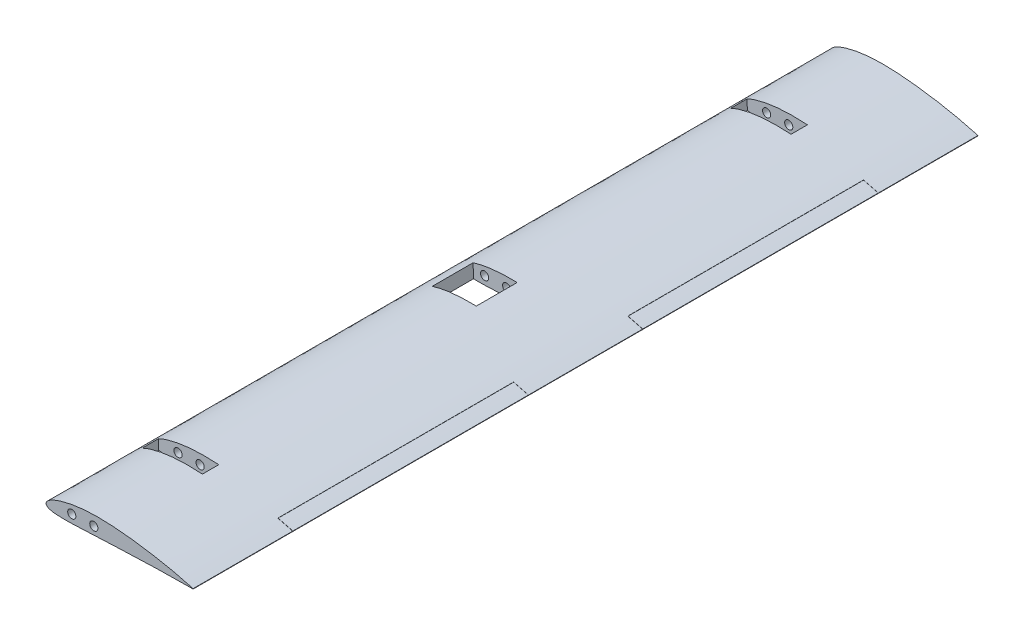
from build123d import *

# Parameters (mm, degrees)
SKETCH2_R               = 6.35
EXTRUDE_AIRFOIL_DEPTH   = 1219.2
AILERONS_DEPTH          = 1241.930446903
AILERONS_DEPTH_BACK     = 1241.930446903
CUT_EXTRUDE1_DEPTH      = 1241.650515326
CUT_EXTRUDE1_DEPTH_BACK = 1241.650515326
SKETCH5_W               = 25.4
SKETCH5_H               = 93.98
SKETCH5_W_2             = 63.5
SKETCH5_H_2             = 68.58


with BuildPart() as part:
    # Sketch2 → Extrude airfoil (new body)
    with BuildSketch(Plane.XY):
        with BuildLine():
            Line((228.6, 12.387025086), (228.6, 11.792831891))
            add(Edge.make_bspline(
                [(228.6, 12.387025086), (224.79499634, 13.422833003), (217.203351463, 15.489450166), (201.995086366, 19.24706995), (182.976626701, 23.398782778), (160.101034919, 27.491378445), (137.243176809, 30.846032277), (114.372582505, 33.23890504), (91.503980941, 34.73131665), (72.412997667, 34.746410141), (57.169927463, 33.691843848), (45.722178876, 32.302790192), (34.249688597, 30.254339076), (24.742840243, 27.790786051), (17.124502123, 25.302700119), (11.38009907, 22.953832003), (6.478661385, 20.413593164), (2.224209454, 17.375019555), (-1.479318567, 12.488031674), (2.518152586, 8.750563835), (6.597176672, 7.283468722), (11.455013829, 6.293244116), (17.192107473, 5.789786203), (24.819037957, 5.433479126), (34.346917188, 5.460166768), (45.776283997, 5.77999863), (57.197586321, 6.388979964), (72.433369023, 7.101546318), (91.474845089, 8.015960902), (114.332736884, 8.874603332), (137.183285679, 9.828052553), (160.036020936, 10.640146808), (182.890586988, 11.237493082), (201.936912913, 11.54078297), (217.172860417, 11.740515028), (224.791022029, 11.77539325), (228.6, 11.792831891)],
                knots=[0, 0, 0, 0, 0.025304886, 0.050487653, 0.100520433, 0.150190716, 0.199586607, 0.248740009, 0.297715539, 0.346600594, 0.371102737, 0.395726297, 0.420570145, 0.445825119, 0.458702216, 0.471919982, 0.485786003, 0.493461051, 0.506863029, 0.51614777, 0.522766003, 0.535269014, 0.547551134, 0.559786371, 0.584228898, 0.60868081, 0.633151284, 0.657621757, 0.706558114, 0.75548187, 0.804405627, 0.853320224, 0.902221408, 0.951113136, 0.975557228, 1, 1, 1, 1], degree=3))
        make_face()
        with Locations(Location((40.005, 18.43992729, 0), (0, 0, 180))):
            Circle(SKETCH2_R, mode=Mode.SUBTRACT)
        with Locations(Location((74.283249673, 19.337534848, 0), (0, 0, 180))):
            Circle(SKETCH2_R, mode=Mode.SUBTRACT)
    extrude(amount=EXTRUDE_AIRFOIL_DEPTH)

    # Sketch3 → Ailerons (cut, two sides: drawn at the far end of the back side and taken through both)
    with BuildSketch(Plane(origin=(0, 0, 0), x_dir=(1, 0, 0), z_dir=(0, 1, 0)).offset(-AILERONS_DEPTH_BACK)):
        Polygon((228.6, -520.7), (205.74, -520.7), (205.74, -154.94), (228.6, -154.94), (228.6, -154.686), (205.486, -154.686), (205.486, -520.954), (228.6, -520.954), align=None)
        Polygon((228.6, -1064.26), (205.74, -1064.26), (205.74, -698.5), (228.6, -698.5), (228.6, -698.246), (205.486, -698.246), (205.486, -1064.514), (228.6, -1064.514), align=None)
    extrude(amount=AILERONS_DEPTH + AILERONS_DEPTH_BACK, mode=Mode.SUBTRACT)


with BuildPart() as ailerons_piece_1:
    # of the separate pieces the step leaves, piece 1, a body of its own (ailerons_pieces)
    add(part.part.solids().sort_by_distance((228.6, 12.387025086, 0))[0])

    # Sketch5 → Cut-Extrude1 (cut, two sides: drawn at the far end of the back side and taken through both)
    with BuildSketch(Plane(origin=(-0.455122883, 17.380441686, 0), x_dir=(0, 0, -1), z_dir=(-0.026176948307859344, 0.9996573249755578, 0)).offset(-CUT_EXTRUDE1_DEPTH_BACK)):
        with Locations((-1066.8, -57.15)):
            Rectangle(SKETCH5_W, SKETCH5_H)
        with Locations((-152.4, -57.15)):
            Rectangle(SKETCH5_W, SKETCH5_H)
        with Locations((-609.6, -57.15)):
            Rectangle(SKETCH5_W_2, SKETCH5_H_2)
    extrude(amount=CUT_EXTRUDE1_DEPTH + CUT_EXTRUDE1_DEPTH_BACK, mode=Mode.SUBTRACT)


with BuildPart() as ailerons_piece_2:
    # of the separate pieces the step leaves, piece 2, a body of its own (ailerons_pieces)
    add(part.part.solids().sort_by_distance((228.6, 11.792831891, 154.94))[0])


with BuildPart() as ailerons_piece_3:
    # of the separate pieces the step leaves, piece 3, a body of its own (ailerons_pieces)
    add(part.part.solids().sort_by_distance((228.6, 11.792831891, 698.5))[0])


solid = Compound([ailerons_piece_1.part, ailerons_piece_2.part, ailerons_piece_3.part])
